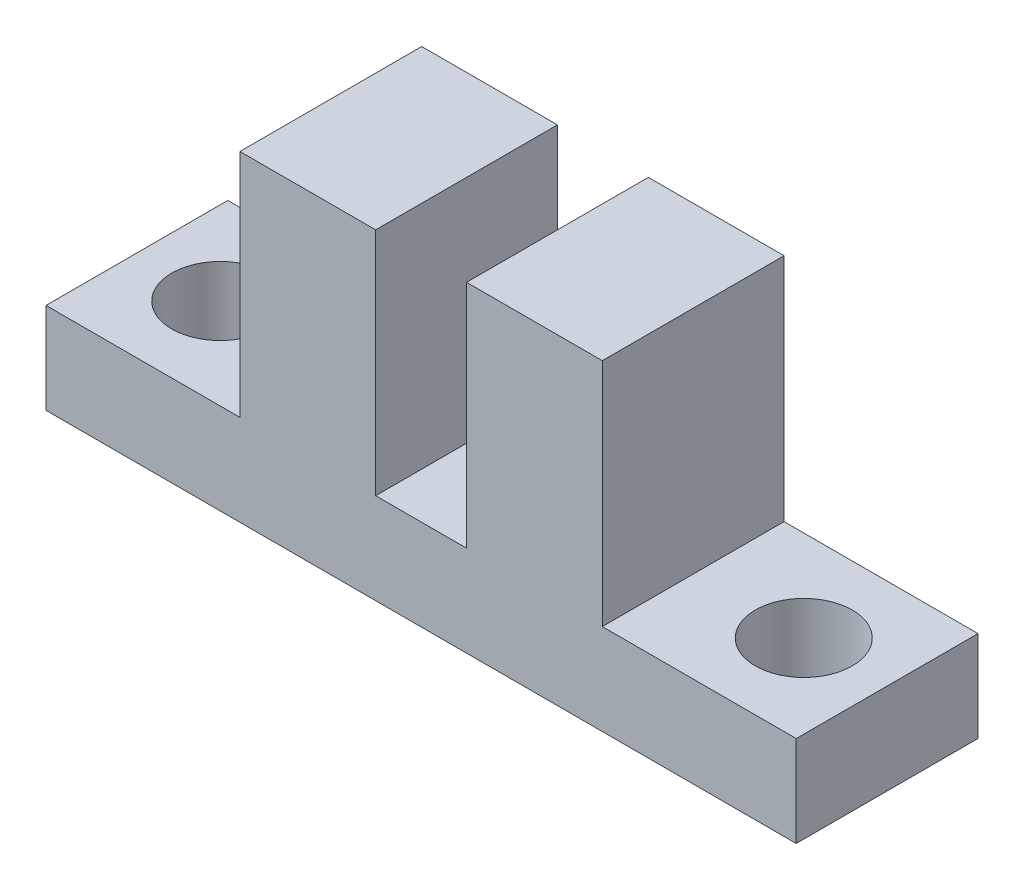
from build123d import *

# Parameters (mm, degrees)
SALIENTE_EXTRUIR1_DEPTH = 6
CROQUIS2_R              = 1.6
CORTAR_EXTRUIR1_DEPTH   = 19.588705184


with BuildPart() as part:
    # Croquis1 → Saliente-Extruir1 (new body)
    with BuildSketch(Plane.XY):
        Polygon((-9.467575758, 5.498181818), (-4.987575758, 5.498181818), (-4.987575758, -2.101818182), (-1.987575758, -2.101818182), (-1.987575758, 5.498181818), (2.492424242, 5.498181818), (2.492424242, -2.101818182), (8.892424242, -2.101818182), (8.892424242, -5.101818182), (-15.867575758, -5.101818182), (-15.867575758, -2.101818182), (-9.467575758, -2.101818182), align=None)
    extrude(amount=SALIENTE_EXTRUIR1_DEPTH)

    # Croquis2 → Cortar-Extruir1 (cut, through all)
    with BuildSketch(Plane(origin=(0, -2.101818182, 0), x_dir=(1, 0, 0), z_dir=(0, 1, 0))):
        with Locations(Location((-13.117575758, -3, 0), (0, 0, 270))):
            Circle(CROQUIS2_R)
        with Locations(Location((6.142424242, -3, 0), (0, 0, 90))):
            Circle(CROQUIS2_R)
    extrude(amount=-CORTAR_EXTRUIR1_DEPTH, mode=Mode.SUBTRACT)


solid = part.part
